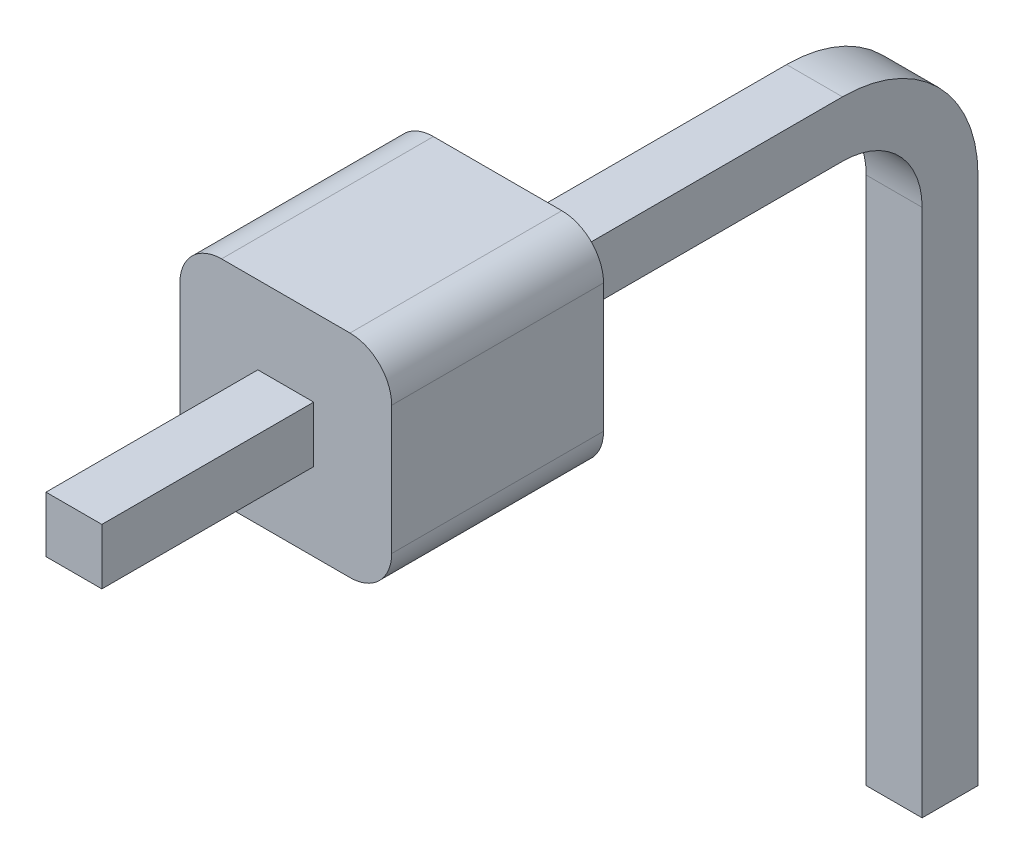
from build123d import *

# Parameters (mm, degrees)
SKETCH_1_W      = 2.54
SKETCH_1_H      = 2.54
EXTRUDE_1_DEPTH = 2.54
SKETCH_2_W      = 0.67
SKETCH_2_H      = 0.67
FILLET_1_R      = 0.5


with BuildPart() as part:
    # 草图1 → 拉伸1 (new body)
    with BuildSketch(Plane.XY):
        with Locations((0, -1.289090726)):
            Rectangle(SKETCH_1_W, SKETCH_1_H)
    extrude(amount=EXTRUDE_1_DEPTH)

    # 扫描1: sweep along a path in 草图3
    with BuildLine(Plane(origin=(0, 0, 0), x_dir=(0, 0, -1), z_dir=(1, 0, 0))) as sweep_1_path:
        Line((-5.08, -1.299090726), (3.8, -1.299090726))
        ThreePointArc((3.8, -1.299090726), (4.70509668, -1.673994046), (5.08, -2.579090726))
        Line((5.08, -2.579090726), (5.08, -8.919090726))
    # 草图2 → 扫描1 (sweep)
    with BuildSketch(Plane(origin=(0, 0, 5.08), x_dir=(-1, 0, 0), z_dir=(0, 0, -1))):
        with Locations((0, -1.289090726)):
            Rectangle(SKETCH_2_W, SKETCH_2_H)
    sweep(path=sweep_1_path.line)

    # 圆角1
    fillet_1_edges = [part.edges().sort_by_distance(p)[0] for p in [
        (-1.27, -0.019090726, 1.27),
        (1.27, -0.019090726, 1.27),
        (1.27, -2.559090726, 1.27),
        (-1.27, -2.559090726, 1.27),
    ]]
    fillet(fillet_1_edges, radius=FILLET_1_R)


solid = part.part
